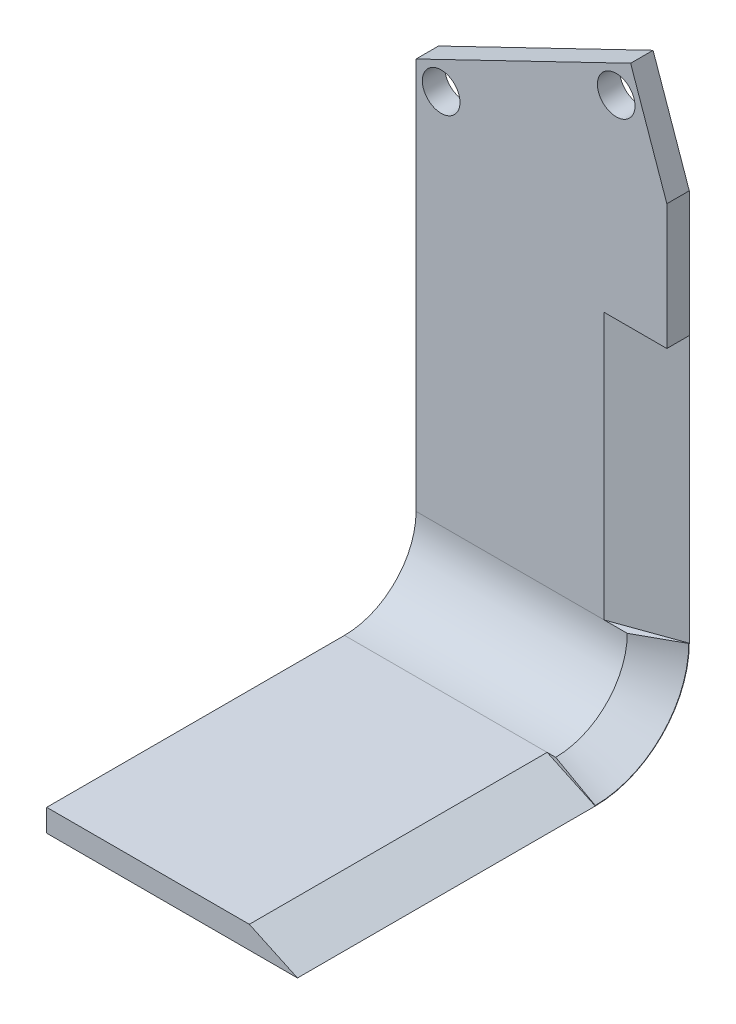
from build123d import *

# Parameters (mm, degrees)
BOSS_EXTRUDE1_DEPTH = 80
BOSS_EXTRUDE2_DEPTH = 7.16
SKETCH3_R           = 6
CUT_EXTRUDE1_DEPTH  = 7.16
CUT_EXTRUDE6_DEPTH  = 95
CUT_EXTRUDE7_DEPTH  = 85
CHAMFER3_SIZE       = 7
CHAMFER3_SIZE2      = 12.628334287
SCALE1_SCALE        = 0.714781685
SCALE2_SCALE        = 0.5
SCALE3_SCALE        = 1.5


with BuildPart() as part:
    # Sketch1 → Boss-Extrude1 (new body)
    with BuildSketch(Plane(origin=(0, 0, 0), x_dir=(0, 0, -1), z_dir=(1, 0, 0))):
        with BuildLine():
            Line((-43.05875576, 0), (51.94124424, 0))
            ThreePointArc((51.94124424, 0), (73.154447675, 8.786796564), (81.94124424, 30))
            Line((81.94124424, 30), (81.94124424, 155))
            Line((81.94124424, 155), (74.78124424, 155))
            Line((74.78124424, 155), (74.78124424, 30))
            ThreePointArc((74.78124424, 30), (68.091563122, 13.849681118), (51.94124424, 7.16))
            Line((51.94124424, 7.16), (-43.05875576, 7.16))
            Line((-43.05875576, 7.16), (-43.05875576, 0))
        make_face()
    extrude(amount=BOSS_EXTRUDE1_DEPTH)

    # Sketch2 → Boss-Extrude2 (add)
    with BuildSketch(Plane.XY.offset(-74.78124424)):
        Polygon((0, 155), (68.44375, 188.037147061), (80, 155), align=None)
    extrude(amount=-BOSS_EXTRUDE2_DEPTH)

    # Sketch3 → Cut-Extrude1 (cut)
    with BuildSketch(Plane.XY.offset(-74.78124424)):
        with Locations((63.851173507, 176.937147061)):
            Circle(SKETCH3_R)
        with Locations((8, 149.978316888)):
            Circle(SKETCH3_R)
    extrude(amount=-CUT_EXTRUDE1_DEPTH, mode=Mode.SUBTRACT)

    # Sketch6 → Cut-Extrude6 (cut)
    with BuildSketch(Plane.XY.offset(43.05875576)):
        Polygon((80, 0), (64.645330449, 7.16), (80, 7.16), align=None)
    extrude(amount=-CUT_EXTRUDE6_DEPTH, mode=Mode.SUBTRACT)

    # Sketch10 → Cut-Extrude7 (cut)
    with BuildSketch(Plane(origin=(0, 115, 0), x_dir=(-1, 0, 0), z_dir=(0, -1, 0))):
        Polygon((-80, 81.94124424), (-60, 74.78124424), (-80, 74.78124424), align=None)
    extrude(amount=CUT_EXTRUDE7_DEPTH, mode=Mode.SUBTRACT)

    # Chamfer3
    chamfer3_edges = [part.edges().sort_by_distance(p)[0] for p in [
        (80, 13.849681118, -68.091563122),
    ]]
    chamfer3_side = [part.faces().sort_by_distance(p)[0] for p in [
        (80, 13.077563731, -68.863680509),
    ]]
    chamfer(chamfer3_edges, length=CHAMFER3_SIZE, length2=CHAMFER3_SIZE2, reference=chamfer3_side[0])


with BuildPart() as part_1:
    # Scale1: scaled about (37.569148968, 54.949559207, -51.822054035)
    add(part.part.scale(SCALE1_SCALE).moved(Location((10.715409355, 15.672620673, -14.780598919))))


with BuildPart() as part_2:
    # Scale2: scaled about (37.569148968, 54.949559207, -51.822054035)
    add(part_1.part.scale(SCALE2_SCALE).moved(Location((18.784574484, 27.474779604, -25.911027018))))


with BuildPart() as part_3:
    # Scale3: scaled about (37.569148968, 54.949559207, -51.822054035)
    add(part_2.part.scale(SCALE3_SCALE).moved(Location((-18.784574484, -27.474779604, 25.911027018))))


solid = part_3.part
